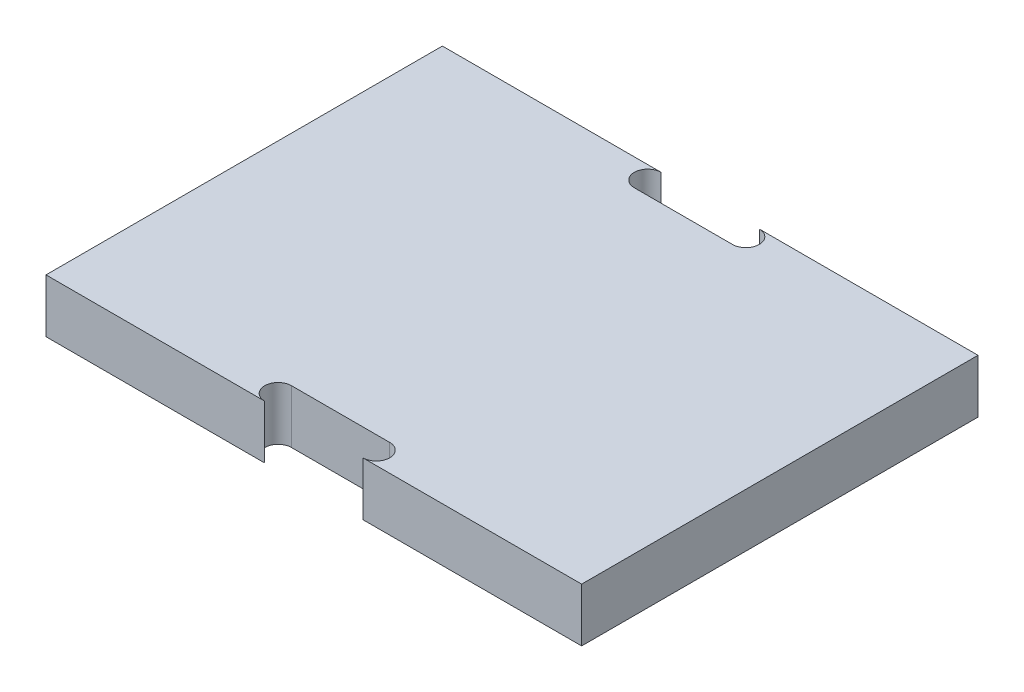
from build123d import *

# Parameters (mm, degrees)
BOSS_EXTRUDE1_DEPTH = 6


with BuildPart() as part:
    # Sketch1 → Boss-Extrude1 (new body)
    with BuildSketch(Plane(origin=(0, 0, 0), x_dir=(1, 0, 0), z_dir=(0, 1, 0))):
        with BuildLine():
            Line((-30, 0), (-30, 22.2))
            Line((-30, 22.2), (-5.5, 22.2))
            ThreePointArc((-5.5, 22.2), (-7, 20.7), (-5.5, 19.2))
            Line((-5.5, 19.2), (0, 19.2))
            Line((0, 19.2), (5.5, 19.2))
            ThreePointArc((5.5, 19.2), (7, 20.7), (5.5, 22.2))
            Line((5.5, 22.2), (30, 22.2))
            Line((30, 22.2), (30, 0))
            Line((30, 0), (30, -22.2))
            Line((30, -22.2), (5.5, -22.2))
            ThreePointArc((5.5, -22.2), (7, -20.7), (5.5, -19.2))
            Line((5.5, -19.2), (0, -19.2))
            Line((0, -19.2), (-5.5, -19.2))
            ThreePointArc((-5.5, -19.2), (-7, -20.7), (-5.5, -22.2))
            Line((-5.5, -22.2), (-30, -22.2))
            Line((-30, -22.2), (-30, 0))
        make_face()
    extrude(amount=BOSS_EXTRUDE1_DEPTH)


solid = part.part
